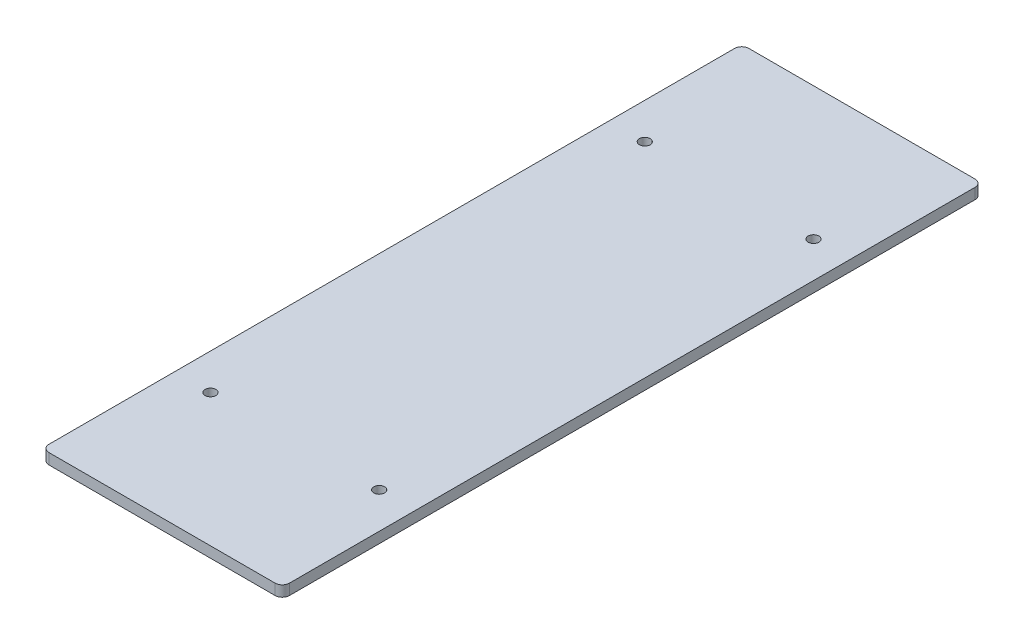
from build123d import *

# Parameters (mm, degrees)
SKETCH1_W           = 67
SKETCH1_H           = 195
BOSS_EXTRUDE1_DEPTH = 3
SKETCH2_R           = 1.5
CUT_EXTRUDE1_DEPTH  = 3
FILLET1_R           = 2


with BuildPart() as part:
    # Sketch1 → Boss-Extrude1 (new body)
    with BuildSketch(Plane(origin=(0, 0, 0), x_dir=(1, 0, 0), z_dir=(0, 1, 0))):
        Rectangle(SKETCH1_W, SKETCH1_H)
    extrude(amount=BOSS_EXTRUDE1_DEPTH)

    # Sketch2 → Cut-Extrude1 (cut)
    with BuildSketch(Plane(origin=(0, 3, 0), x_dir=(1, 0, 0), z_dir=(0, 1, 0))):
        with Locations(Location((-23.5, 60.5, 0), (0, 0, 270))):
            Circle(SKETCH2_R)
        with Locations(Location((23.5, 60.5, 0), (0, 0, 270))):
            Circle(SKETCH2_R)
        with Locations(Location((-23.5, -60.5, 0), (0, 0, 270))):
            Circle(SKETCH2_R)
        with Locations(Location((23.5, -60.5, 0), (0, 0, 270))):
            Circle(SKETCH2_R)
    extrude(amount=-CUT_EXTRUDE1_DEPTH, mode=Mode.SUBTRACT)

    # Fillet1
    fillet1_edges = [part.edges().sort_by_distance(p)[0] for p in [
        (33.5, 1.5, 97.5),
        (-33.5, 1.5, 97.5),
        (-33.5, 1.5, -97.5),
        (33.5, 1.5, -97.5),
    ]]
    fillet(fillet1_edges, radius=FILLET1_R)


solid = part.part
